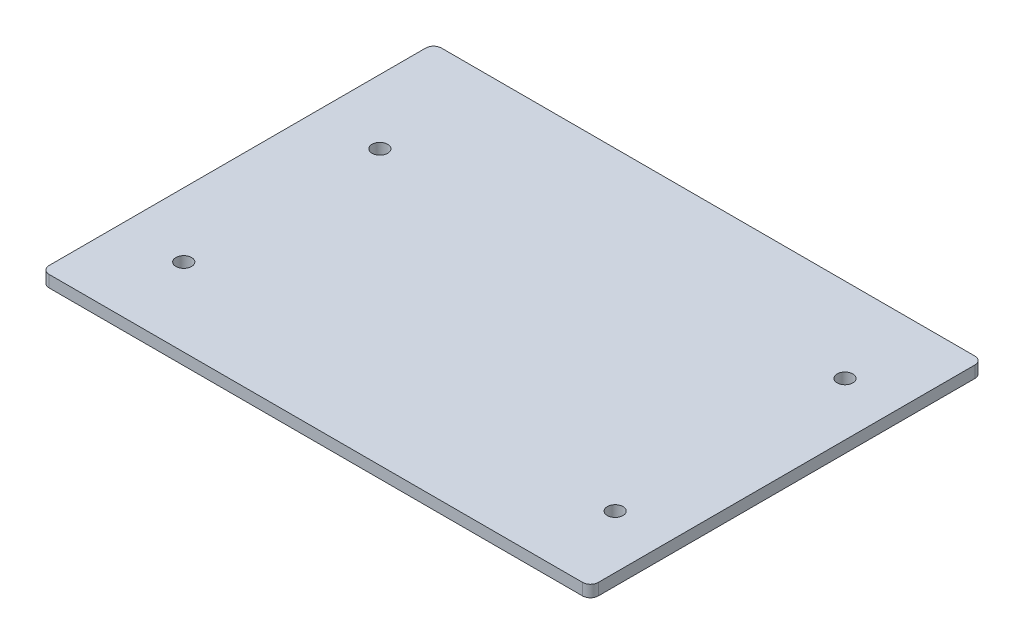
from build123d import *

# Parameters (mm, degrees)
SKETCH_1_R      = 2
EXTRUDE_1_DEPTH = 3
FILLET_1_R      = 2


with BuildPart() as part:
    # 草图1 → 凸台-拉伸1 (new body)
    with BuildSketch(Plane(origin=(0, 0, 0), x_dir=(1, 0, 0), z_dir=(0, 1, 0))):
        Polygon((0, 0), (0, -50), (140, -50), (140, 50), (0, 50), align=None)
        with Locations(Location((16.4, -30.1, 0), (0, 0, 270))):
            Circle(SKETCH_1_R, mode=Mode.SUBTRACT)
        with Locations(Location((16.4, 19.9, 0), (0, 0, 270))):
            Circle(SKETCH_1_R, mode=Mode.SUBTRACT)
        with Locations(Location((126.4, 28.5, 0), (0, 0, 270))):
            Circle(SKETCH_1_R, mode=Mode.SUBTRACT)
        with Locations(Location((126.4, -30.1, 0), (0, 0, 270))):
            Circle(SKETCH_1_R, mode=Mode.SUBTRACT)
    extrude(amount=EXTRUDE_1_DEPTH)

    # 圆角1
    fillet_1_edges = [part.edges().sort_by_distance(p)[0] for p in [
        (0, 1.5, 50),
        (0, 1.5, -50),
        (140, 1.5, -50),
        (140, 1.5, 50),
    ]]
    fillet(fillet_1_edges, radius=FILLET_1_R)


solid = part.part
